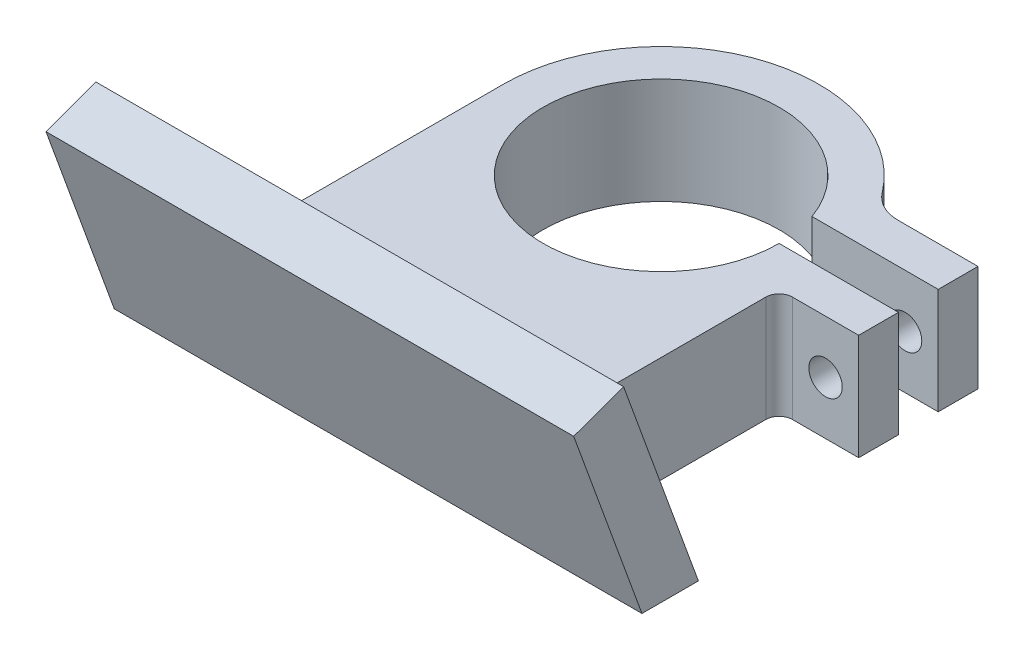
from build123d import *

# Parameters (mm, degrees)
BOSS_EXTRUDE1_DEPTH = 10.16
CUT_EXTRUDE1_REACH  = 48.698
SKETCH3_W           = 50.546
SKETCH3_H           = 20.972046169
BOSS_EXTRUDE2_DEPTH = 5.08
CUT_EXTRUDE2_REACH  = 65.84
FILLET1_R           = 5.08
FILLET2_R           = 3.81
FILLET3_R           = 1.27
SKETCH5_R           = 1.5999968
CUT_EXTRUDE3_DEPTH  = 44.788596105


with BuildPart() as part:
    # Sketch1 → Boss-Extrude1 (new body)
    with BuildSketch(Plane(origin=(0, 0, 0), x_dir=(1, 0, 0), z_dir=(0, 1, 0))):
        with BuildLine():
            Line((-15.113, 0), (-15.113, -25.4))
            Line((-15.113, -25.4), (15.113, -25.4))
            Line((15.113, -25.4), (15.113, -3.81))
            Line((15.113, -3.81), (22.733, -3.81))
            Line((22.733, -3.81), (22.733, 0))
            Line((22.733, 0), (15.113, 0))
            Line((15.113, 0), (11.303, 0))
            ThreePointArc((11.303, 0), (-11.136399388, -1.933498813), (10.641508775, 3.81))
            Line((10.641508775, 3.81), (22.733, 3.81))
            Line((22.733, 3.81), (22.733, 7.62))
            Line((22.733, 7.62), (13.051374219, 7.62))
            ThreePointArc((13.051374219, 7.62), (-3.946983052, 14.588491827), (-15.113, 0))
        make_face()
    extrude(amount=BOSS_EXTRUDE1_DEPTH)

    # Sketch2 → Cut-Extrude1 (cut, up to next)
    with BuildSketch(Plane.ZY.offset(15.113), mode=Mode.PRIVATE) as cut_extrude1_sk1:
        Polygon((25.4, 10.16), (21.70206242, 0), (25.4, 0), align=None)
    cut_extrude1_tool1 = extrude(cut_extrude1_sk1.sketch, amount=-CUT_EXTRUDE1_REACH, mode=Mode.PRIVATE) & part.part
    add(cut_extrude1_tool1.solids().sort_by_distance((-15.113, 3.386667, 24.167354))[0], mode=Mode.SUBTRACT)

    # Sketch3 → Boss-Extrude2 (add)
    with BuildSketch(Plane(origin=(0, -6.974908414, 19.16340337), x_dir=(1, 0, 0), z_dir=(0, -0.34202014332566916, 0.9396926207859082))):
        with Locations((0, 17.908565583)):
            Rectangle(SKETCH3_W, SKETCH3_H)
    extrude(amount=BOSS_EXTRUDE2_DEPTH)

    # Sketch4 → Cut-Extrude2 (cut, up to next)
    with BuildSketch(Plane.ZY.offset(25.273), mode=Mode.PRIVATE) as cut_extrude2_sk1:
        Polygon((27.108085504, 0), (26.475700933, -1.737462328), (21.70206242, 0), align=None)
    cut_extrude2_tool1 = extrude(cut_extrude2_sk1.sketch, amount=-CUT_EXTRUDE2_REACH, mode=Mode.PRIVATE) & part.part
    add(cut_extrude2_tool1.solids().sort_by_distance((-25.273, -0.579154, 25.095283))[0], mode=Mode.SUBTRACT)

    # Fillet1
    fillet1_edges = [part.edges().sort_by_distance(p)[0] for p in [
        (-15.113, 5.08, 23.55103121),
        (15.113, 5.08, 23.55103121),
        (0, 10.16, 25.4),
    ]]
    fillet(fillet1_edges, radius=FILLET1_R)

    # Fillet2
    fillet2_edges = [part.edges().sort_by_distance(p)[0] for p in [
        (13.051374219, 5.08, -7.62),
    ]]
    fillet(fillet2_edges, radius=FILLET2_R)

    # Fillet3
    fillet3_edges = [part.edges().sort_by_distance(p)[0] for p in [
        (15.113, 5.08, 3.81),
    ]]
    fillet(fillet3_edges, radius=FILLET3_R)

    # Sketch5 → Cut-Extrude3 (cut, through all)
    with BuildSketch(Plane.XY.offset(3.81)):
        with Locations((19.558, 5.08)):
            Circle(SKETCH5_R)
    extrude(amount=-CUT_EXTRUDE3_DEPTH, mode=Mode.SUBTRACT)


solid = part.part
